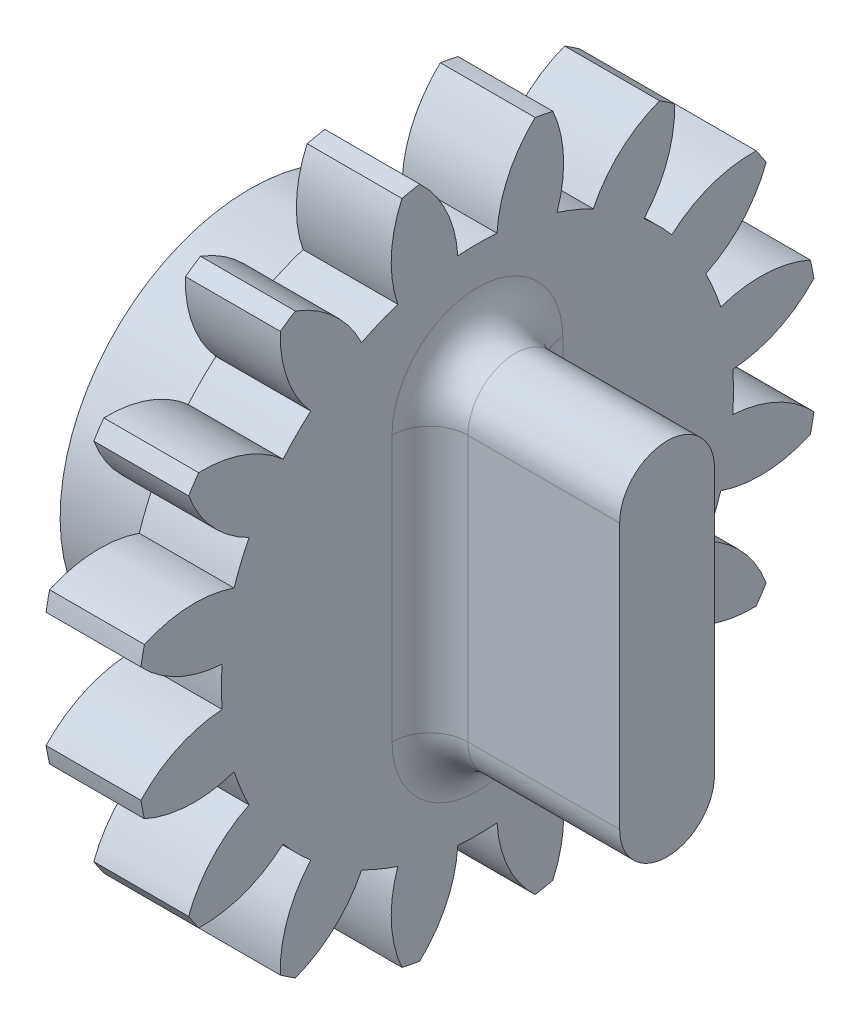
from build123d import *

# Parameters (mm, degrees)
BASPROSKE_W              = 5
BASPROSKE_H              = 18
TOOTHCUT_DEPTH           = 26.942243542
TEETHCUTS_COUNT          = 16
TEETHCUTS_ANGLE          = 337.5
BORSKE_R                 = 2.5
BORE_DEPTH               = 50.0000508
BOSS_EXTRUDE1_DEPTH      = 7
BOSS_EXTRUDE1_DEPTH_BACK = 5
SKETCH1_R                = 10
SKETCH2_R                = 1.25
BOSS_EXTRUDE3_DEPTH      = 1.8
BOSS_EXTRUDE4_DEPTH      = 10
FILLET1_R                = 2


with BuildPart() as part:
    # BasProSke → Base-Revolve (revolve)
    with BuildSketch(Plane(origin=(0, 0, 0), x_dir=(1, 0, 0), z_dir=(0, 1, 0)), mode=Mode.PRIVATE) as base_revolve_sk:
        with Locations((2.5, 9)):
            Rectangle(BASPROSKE_W, BASPROSKE_H)
    revolve(base_revolve_sk.sketch.rotate(Axis((-10, 0, 0), (1, 0, 0)), 180), axis=Axis((-10, 0, 0), (1, 0, 0)))

    # TooCutSke → ToothCut (cut, through all)
    with BuildSketch(Plane(origin=(0, 0, 0), x_dir=(0, 0, -1), z_dir=(1, 0, 0))):
        with BuildLine():
            ThreePointArc((1.03434411, 13.459313997), (0, 13.499), (-1.03434411, 13.459313997))
            ThreePointArc((-1.03434411, 13.459313997), (-1.635143665, 15.806872195), (-3.065655864, 17.762792553))
            ThreePointArc((-3.065655864, 17.762792553), (0, 18.0254), (3.065655864, 17.762792553))
            ThreePointArc((3.065655864, 17.762792553), (1.635143665, 15.806872195), (1.03434411, 13.459313997))
        make_face()
    toothcut = extrude(amount=TOOTHCUT_DEPTH, mode=Mode.SUBTRACT)

    # TeethCuts: ToothCut ×16 about axis
    teethcuts_axis = Axis((-10, 0, 0), (1, 0, 0))
    for i in range(1, TEETHCUTS_COUNT):
        add(toothcut.rotate(teethcuts_axis, i * TEETHCUTS_ANGLE / (TEETHCUTS_COUNT - 1)), mode=Mode.SUBTRACT)

    # BorSke → Bore (cut, symmetric)
    with BuildSketch(Plane(origin=(0, 0, 0), x_dir=(0, 0, -1), z_dir=(1, 0, 0))):
        with Locations(Location((0, 0, 0), (0, 0, 180))):
            Circle(BORSKE_R)
    extrude(amount=BORE_DEPTH, both=True, mode=Mode.SUBTRACT)

    # Sketch1 → Boss-Extrude1 (add, two sides: drawn at the far end of the back side and taken through both)
    with BuildSketch(Plane.ZY.offset(-BOSS_EXTRUDE1_DEPTH_BACK)):
        Circle(SKETCH1_R)
    extrude(amount=BOSS_EXTRUDE1_DEPTH + BOSS_EXTRUDE1_DEPTH_BACK)

    # Sketch2 → Boss-Extrude3 (add)
    with BuildSketch(Plane.ZY.offset(7)):
        with Locations((-9.092660354, 4.162154213)):
            Circle(SKETCH2_R)
    extrude(amount=-BOSS_EXTRUDE3_DEPTH)

    # Sketch3 → Boss-Extrude4 (add)
    with BuildSketch(Plane(origin=(5, 0, 0), x_dir=(0, 0, -1), z_dir=(1, 0, 0))):
        with BuildLine():
            Line((2.5, 7), (2.5, -7))
            ThreePointArc((2.5, -7), (0, -9.5), (-2.5, -7))
            Line((-2.5, -7), (-2.5, 7))
            ThreePointArc((-2.5, 7), (0, 9.5), (2.5, 7))
        make_face()
    extrude(amount=BOSS_EXTRUDE4_DEPTH)

    # Fillet1
    fillet1_edges = [part.edges().sort_by_distance(p)[0] for p in [
        (5, 9.5, 0),
        (5, 0, 2.5),
        (5, -9.5, 0),
        (5, 0, -2.5),
    ]]
    fillet(fillet1_edges, radius=FILLET1_R)


solid = part.part
